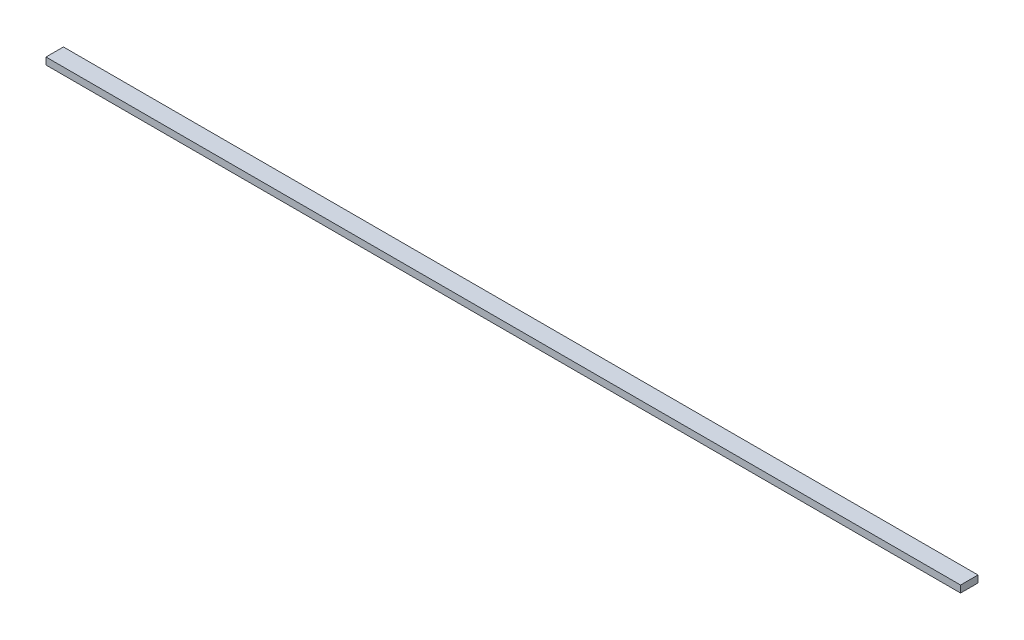
from build123d import *

# Parameters (mm, degrees)
CROQUIS2_W              = 200
CROQUIS2_H              = 80
SALIENTE_EXTRUIR1_DEPTH = 10500


with BuildPart() as part:
    # Croquis2 → Saliente-Extruir1 (new body)
    with BuildSketch(Plane(origin=(0, 0, 0), x_dir=(0, 0, -1), z_dir=(1, 0, 0))):
        with Locations((100, -40)):
            Rectangle(CROQUIS2_W, CROQUIS2_H)
    extrude(amount=SALIENTE_EXTRUIR1_DEPTH)


solid = part.part
